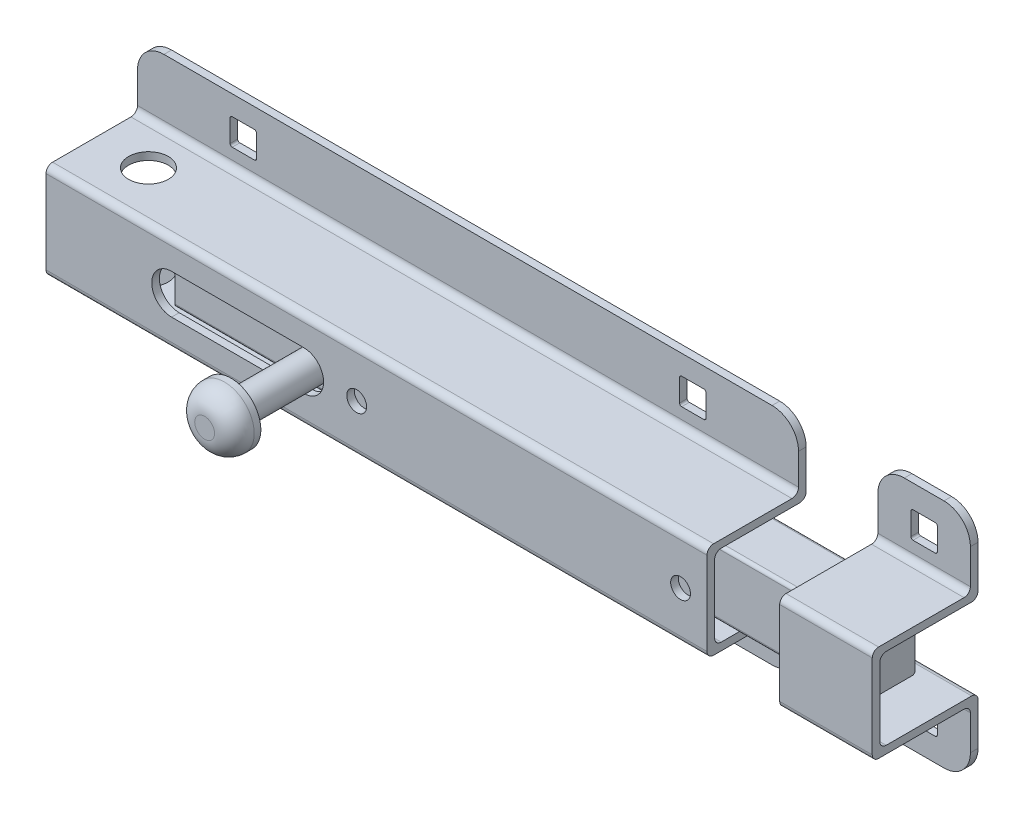
from build123d import *

# Parameters (mm, degrees)
BOSS_EXTRUDE1_DEPTH = 79.375
FILLET1_R           = 6.35
CUT_EXTRUDE1_REACH  = 89.154
SKETCH5_R           = 2.38125
SKETCH6_R           = 4.7625
CUT_EXTRUDE2_DEPTH  = 92.411393185
CUT_EXTRUDE3_DEPTH  = 87.671788068
BOSS_EXTRUDE2_DEPTH = 165.1
BOSS_EXTRUDE3_DEPTH = 11.1125
FILLET3_R           = 6.35
CUT_EXTRUDE4_DEPTH  = 133.005728266


with BuildPart() as part:
    # Sketch4 → Boss-Extrude1 (new, symmetric)
    with BuildSketch(Plane(origin=(0, 0, 0), x_dir=(0, 0, -1), z_dir=(1, 0, 0))):
        with BuildLine():
            Line((1.8288, 0), (0, 0))
            Line((0, 0), (0, 10.0076))
            ThreePointArc((0, 10.0076), (0.464967985, 11.130132015), (1.5875, 11.5951))
            Line((1.5875, 11.5951), (20.3962, 11.5951))
            ThreePointArc((20.3962, 11.5951), (21.518732015, 12.060067985), (21.9837, 13.1826))
            Line((21.9837, 13.1826), (21.9837, 26.9875))
            Line((21.9837, 26.9875), (23.8125, 26.9875))
            Line((23.8125, 26.9875), (23.8125, 11.3538))
            ThreePointArc((23.8125, 11.3538), (23.347532015, 10.231267985), (22.225, 9.7663))
            Line((22.225, 9.7663), (3.4163, 9.7663))
            ThreePointArc((3.4163, 9.7663), (2.293767985, 9.301332015), (1.8288, 8.1788))
            Line((1.8288, 8.1788), (1.8288, 0))
        make_face()
    boss_extrude1 = extrude(amount=BOSS_EXTRUDE1_DEPTH, both=True)

    # Mirror1: Boss-Extrude1 across plane
    add(boss_extrude1.mirror(Plane.ZX))

    # Fillet1
    fillet1_edges = [part.edges().sort_by_distance(p)[0] for p in [
        (-79.375, 26.9875, -22.8981),
        (79.375, 26.9875, -22.8981),
        (79.375, -26.9875, -22.8981),
        (-79.375, -26.9875, -22.8981),
    ]]
    fillet(fillet1_edges, radius=FILLET1_R)

    # Sketch5 → Cut-Extrude1 (cut, up to next)
    with BuildSketch(Plane.XY, mode=Mode.PRIVATE) as cut_extrude1_sk1:
        with Locations((73.025, 0)):
            Circle(SKETCH5_R)
    cut_extrude1_tool1 = extrude(cut_extrude1_sk1.sketch, amount=-CUT_EXTRUDE1_REACH, mode=Mode.PRIVATE) & part.part
    # Sketch5 → Cut-Extrude1 (cut, up to next)
    with BuildSketch(Plane.XY, mode=Mode.PRIVATE) as cut_extrude1_sk2:
        with Locations((-4.7625, 0)):
            Circle(SKETCH5_R)
    cut_extrude1_tool2 = extrude(cut_extrude1_sk2.sketch, amount=-CUT_EXTRUDE1_REACH, mode=Mode.PRIVATE) & part.part
    # Sketch5 → Cut-Extrude1 (cut, up to next)
    with BuildSketch(Plane.XY, mode=Mode.PRIVATE) as cut_extrude1_sk3:
        with BuildLine():
            Line((-49.2125, 4.7625), (-17.4625, 4.7625))
            ThreePointArc((-17.4625, 4.7625), (-12.7, 0), (-17.4625, -4.7625))
            Line((-17.4625, -4.7625), (-49.2125, -4.7625))
            ThreePointArc((-49.2125, -4.7625), (-53.975, 0), (-49.2125, 4.7625))
        make_face()
    cut_extrude1_tool3 = extrude(cut_extrude1_sk3.sketch, amount=-CUT_EXTRUDE1_REACH, mode=Mode.PRIVATE) & part.part
    add(cut_extrude1_tool1.solids().sort_by_distance((73.025, 0, 0))[0], mode=Mode.SUBTRACT)
    add(cut_extrude1_tool2.solids().sort_by_distance((-4.7625, 0, 0))[0], mode=Mode.SUBTRACT)
    add(cut_extrude1_tool3.solids().sort_by_distance((-33.3375, 0, 0))[0], mode=Mode.SUBTRACT)

    # Sketch6 → Cut-Extrude2 (cut, through all)
    with BuildSketch(Plane.XZ.offset(11.5951)):
        with Locations(Location((-66.675, -11.90625, 0), (0, 0, 270))):
            Circle(SKETCH6_R)
    extrude(amount=-CUT_EXTRUDE2_DEPTH, mode=Mode.SUBTRACT)

    # Sketch7 → Cut-Extrude3 (cut, through all)
    with BuildSketch(Plane.XY.offset(-21.9837)):
        with BuildLine():
            Line((-56.642, 22.225), (-51.308, 22.225))
            ThreePointArc((-51.308, 22.225), (-50.948789755, 22.076210245), (-50.8, 21.717))
            Line((-50.8, 21.717), (-50.8, 16.383))
            ThreePointArc((-50.8, 16.383), (-50.948789755, 16.023789755), (-51.308, 15.875))
            Line((-51.308, 15.875), (-56.642, 15.875))
            ThreePointArc((-56.642, 15.875), (-57.001210245, 16.023789755), (-57.15, 16.383))
            Line((-57.15, 16.383), (-57.15, 21.717))
            ThreePointArc((-57.15, 21.717), (-57.001210245, 22.076210245), (-56.642, 22.225))
        make_face()
        with BuildLine():
            Line((51.308, 22.225), (56.642, 22.225))
            ThreePointArc((56.642, 22.225), (57.001210245, 22.076210245), (57.15, 21.717))
            Line((57.15, 21.717), (57.15, 16.383))
            ThreePointArc((57.15, 16.383), (57.001210245, 16.023789755), (56.642, 15.875))
            Line((56.642, 15.875), (51.308, 15.875))
            ThreePointArc((51.308, 15.875), (50.948789755, 16.023789755), (50.8, 16.383))
            Line((50.8, 16.383), (50.8, 21.717))
            ThreePointArc((50.8, 21.717), (50.948789755, 22.076210245), (51.308, 22.225))
        make_face()
        with BuildLine():
            Line((51.308, -15.875), (56.642, -15.875))
            ThreePointArc((56.642, -15.875), (57.001210245, -16.023789755), (57.15, -16.383))
            Line((57.15, -16.383), (57.15, -21.717))
            ThreePointArc((57.15, -21.717), (57.001210245, -22.076210245), (56.642, -22.225))
            Line((56.642, -22.225), (51.308, -22.225))
            ThreePointArc((51.308, -22.225), (50.948789755, -22.076210245), (50.8, -21.717))
            Line((50.8, -21.717), (50.8, -16.383))
            ThreePointArc((50.8, -16.383), (50.948789755, -16.023789755), (51.308, -15.875))
        make_face()
        with BuildLine():
            Line((-56.642, -15.875), (-51.308, -15.875))
            ThreePointArc((-51.308, -15.875), (-50.948789755, -16.023789755), (-50.8, -16.383))
            Line((-50.8, -16.383), (-50.8, -21.717))
            ThreePointArc((-50.8, -21.717), (-50.948789755, -22.076210245), (-51.308, -22.225))
            Line((-51.308, -22.225), (-56.642, -22.225))
            ThreePointArc((-56.642, -22.225), (-57.001210245, -22.076210245), (-57.15, -21.717))
            Line((-57.15, -21.717), (-57.15, -16.383))
            ThreePointArc((-57.15, -16.383), (-57.001210245, -16.023789755), (-56.642, -15.875))
        make_face()
    extrude(amount=-CUT_EXTRUDE3_DEPTH, mode=Mode.SUBTRACT)


with BuildPart() as body_2:
    # Sketch8 → Boss-Extrude2 (new body)
    with BuildSketch(Plane(origin=(111.125, 0, 0), x_dir=(0, 0, -1), z_dir=(1, 0, 0))):
        with BuildLine():
            Line((6.31825, 7.9375), (17.49425, 7.9375))
            ThreePointArc((17.49425, 7.9375), (18.033065367, 7.714315367), (18.25625, 7.1755))
            Line((18.25625, 7.1755), (18.25625, -7.1755))
            ThreePointArc((18.25625, -7.1755), (18.033065367, -7.714315367), (17.49425, -7.9375))
            Line((17.49425, -7.9375), (6.31825, -7.9375))
            ThreePointArc((6.31825, -7.9375), (5.779434633, -7.714315367), (5.55625, -7.1755))
            Line((5.55625, -7.1755), (5.55625, 7.1755))
            ThreePointArc((5.55625, 7.1755), (5.779434633, 7.714315367), (6.31825, 7.9375))
        make_face()
    extrude(amount=-BOSS_EXTRUDE2_DEPTH)

    # Sketch12 → Revolve1 (revolve)
    with BuildSketch(Plane(origin=(0, 0, 0), x_dir=(1, 0, 0), z_dir=(0, 1, 0)), mode=Mode.PRIVATE) as revolve1_sk:
        with BuildLine():
            Line((-17.4625, 5.55625), (-17.4625, -23.8125))
            Line((-17.4625, -23.8125), (-15.08125, -23.8125))
            ThreePointArc((-15.08125, -23.8125), (-11.713653955, -22.417596045), (-10.31875, -19.05))
            Line((-10.31875, -19.05), (-10.31875, -17.4625))
            Line((-10.31875, -17.4625), (-13.890625, -17.4625))
            Line((-13.890625, -17.4625), (-13.890625, 5.55625))
            Line((-13.890625, 5.55625), (-17.4625, 5.55625))
        make_face()
    revolve(revolve1_sk.sketch.rotate(Axis((-17.4625, 0, -65.228925589), (0, 0, 1)), 180), axis=Axis((-17.4625, 0, -65.228925589), (0, 0, 1)))


with BuildPart() as body_3:
    # Sketch13 → Boss-Extrude3 (new, symmetric)
    with BuildSketch(Plane(origin=(109.5375, 0, 0), x_dir=(0, 0, -1), z_dir=(1, 0, 0))):
        with BuildLine():
            Line((-1.5875, 0), (0.2413, 0))
            Line((0.2413, 0), (0.2413, 8.2423))
            ThreePointArc((0.2413, 8.2423), (0.687669265, 9.319930735), (1.7653, 9.7663))
            Line((1.7653, 9.7663), (22.2885, 9.7663))
            ThreePointArc((22.2885, 9.7663), (23.366130735, 10.212669265), (23.8125, 11.2903))
            Line((23.8125, 11.2903), (23.8125, 27.78125))
            Line((23.8125, 27.78125), (21.9837, 27.78125))
            Line((21.9837, 27.78125), (21.9837, 13.1191))
            ThreePointArc((21.9837, 13.1191), (21.537330735, 12.041469265), (20.4597, 11.5951))
            Line((20.4597, 11.5951), (-0.0635, 11.5951))
            ThreePointArc((-0.0635, 11.5951), (-1.141130735, 11.148730735), (-1.5875, 10.0711))
            Line((-1.5875, 10.0711), (-1.5875, 0))
        make_face()
    boss_extrude3 = extrude(amount=BOSS_EXTRUDE3_DEPTH, both=True)

    # Mirror5: Boss-Extrude3 across plane
    add(boss_extrude3.mirror(Plane.ZX))

    # Fillet3
    fillet3_edges = [body_3.edges().sort_by_distance(p)[0] for p in [
        (98.425, 27.78125, -22.8981),
        (120.65, 27.78125, -22.8981),
        (120.65, -27.78125, -22.8981),
        (98.425, -27.78125, -22.8981),
    ]]
    fillet(fillet3_edges, radius=FILLET3_R)

    # Sketch14 → Cut-Extrude4 (cut, through all)
    with BuildSketch(Plane.XY.offset(-21.9837)):
        with BuildLine():
            Line((106.8705, 22.225), (112.2045, 22.225))
            ThreePointArc((112.2045, 22.225), (112.563710245, 22.076210245), (112.7125, 21.717))
            Line((112.7125, 21.717), (112.7125, 16.383))
            ThreePointArc((112.7125, 16.383), (112.563710245, 16.023789755), (112.2045, 15.875))
            Line((112.2045, 15.875), (106.8705, 15.875))
            ThreePointArc((106.8705, 15.875), (106.511289755, 16.023789755), (106.3625, 16.383))
            Line((106.3625, 16.383), (106.3625, 21.717))
            ThreePointArc((106.3625, 21.717), (106.511289755, 22.076210245), (106.8705, 22.225))
        make_face()
        with BuildLine():
            Line((106.8705, -15.875), (112.2045, -15.875))
            ThreePointArc((112.2045, -15.875), (112.563710245, -16.023789755), (112.7125, -16.383))
            Line((112.7125, -16.383), (112.7125, -21.717))
            ThreePointArc((112.7125, -21.717), (112.563710245, -22.076210245), (112.2045, -22.225))
            Line((112.2045, -22.225), (106.8705, -22.225))
            ThreePointArc((106.8705, -22.225), (106.511289755, -22.076210245), (106.3625, -21.717))
            Line((106.3625, -21.717), (106.3625, -16.383))
            ThreePointArc((106.3625, -16.383), (106.511289755, -16.023789755), (106.8705, -15.875))
        make_face()
    extrude(amount=-CUT_EXTRUDE4_DEPTH, mode=Mode.SUBTRACT)


solid = Compound([part.part, body_2.part, body_3.part])
